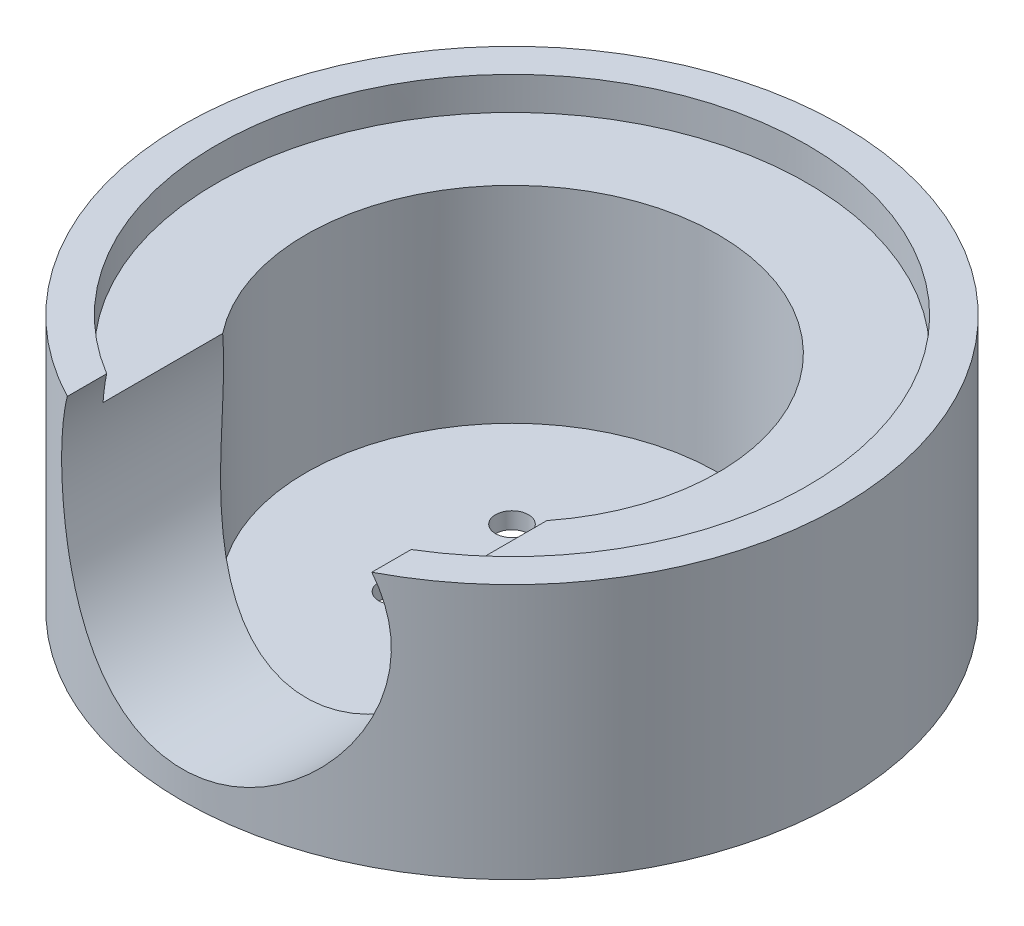
from build123d import *

# Parameters (mm, degrees)
SKETCH1_R           = 24
SKETCH1_R_2         = 1.2
BOSS_EXTRUDE1_DEPTH = 1.2
SKETCH2_R           = 24
SKETCH2_R_2         = 15
BOSS_EXTRUDE2_DEPTH = 15
SKETCH3_R           = 24
SKETCH3_R_2         = 21.5
BOSS_EXTRUDE3_DEPTH = 2.4
SKETCH5_R           = 12
CUT_EXTRUDE2_DEPTH  = 20
SKETCH6_R           = 20
SKETCH6_R_2         = 19
CUT_EXTRUDE3_DEPTH  = 1.6


with BuildPart() as part:
    # Sketch1 → Boss-Extrude1 (new body)
    with BuildSketch(Plane(origin=(0, 0, 0), x_dir=(1, 0, 0), z_dir=(0, 1, 0))):
        with Locations(Location((0, 0, 0), (0, 0, 270))):
            Circle(SKETCH1_R)
        with Locations(Location((4.242640687, 4.242640687, 0), (0, 0, 270))):
            Circle(SKETCH1_R_2, mode=Mode.SUBTRACT)
        with Locations(Location((-4.242640687, 4.242640687, 0), (0, 0, 270))):
            Circle(SKETCH1_R_2, mode=Mode.SUBTRACT)
        with Locations(Location((4.242640687, -4.242640687, 0), (0, 0, 270))):
            Circle(SKETCH1_R_2, mode=Mode.SUBTRACT)
        with Locations(Location((-4.242640687, -4.242640687, 0), (0, 0, 270))):
            Circle(SKETCH1_R_2, mode=Mode.SUBTRACT)
    extrude(amount=BOSS_EXTRUDE1_DEPTH)

    # Sketch2 → Boss-Extrude2 (add)
    with BuildSketch(Plane(origin=(0, 1.2, 0), x_dir=(1, 0, 0), z_dir=(0, 1, 0))):
        with Locations(Location((0, 0, 0), (0, 0, 270))):
            Circle(SKETCH2_R)
        with Locations(Location((0, 0, 0), (0, 0, 270))):
            Circle(SKETCH2_R_2, mode=Mode.SUBTRACT)
    extrude(amount=BOSS_EXTRUDE2_DEPTH)

    # Sketch3 → Boss-Extrude3 (add)
    with BuildSketch(Plane(origin=(0, 16.2, 0), x_dir=(1, 0, 0), z_dir=(0, 1, 0))):
        with Locations(Location((0, 0, 0), (0, 0, 270))):
            Circle(SKETCH3_R)
        with Locations(Location((0, 0, 0), (0, 0, 270))):
            Circle(SKETCH3_R_2, mode=Mode.SUBTRACT)
    extrude(amount=BOSS_EXTRUDE3_DEPTH)

    # Sketch5 → Cut-Extrude2 (cut)
    with BuildSketch(Plane.XY.offset(24)):
        with Locations((0, 14)):
            Circle(SKETCH5_R)
    extrude(amount=-CUT_EXTRUDE2_DEPTH, mode=Mode.SUBTRACT)

    # Sketch6 → Cut-Extrude3 (cut)
    with BuildSketch(Plane.XZ):
        with Locations(Location((0, 0, 0), (0, 0, 270))):
            Circle(SKETCH6_R)
        with Locations(Location((0, 0, 0), (0, 0, 270))):
            Circle(SKETCH6_R_2, mode=Mode.SUBTRACT)
    extrude(amount=-CUT_EXTRUDE3_DEPTH, mode=Mode.SUBTRACT)


solid = part.part
